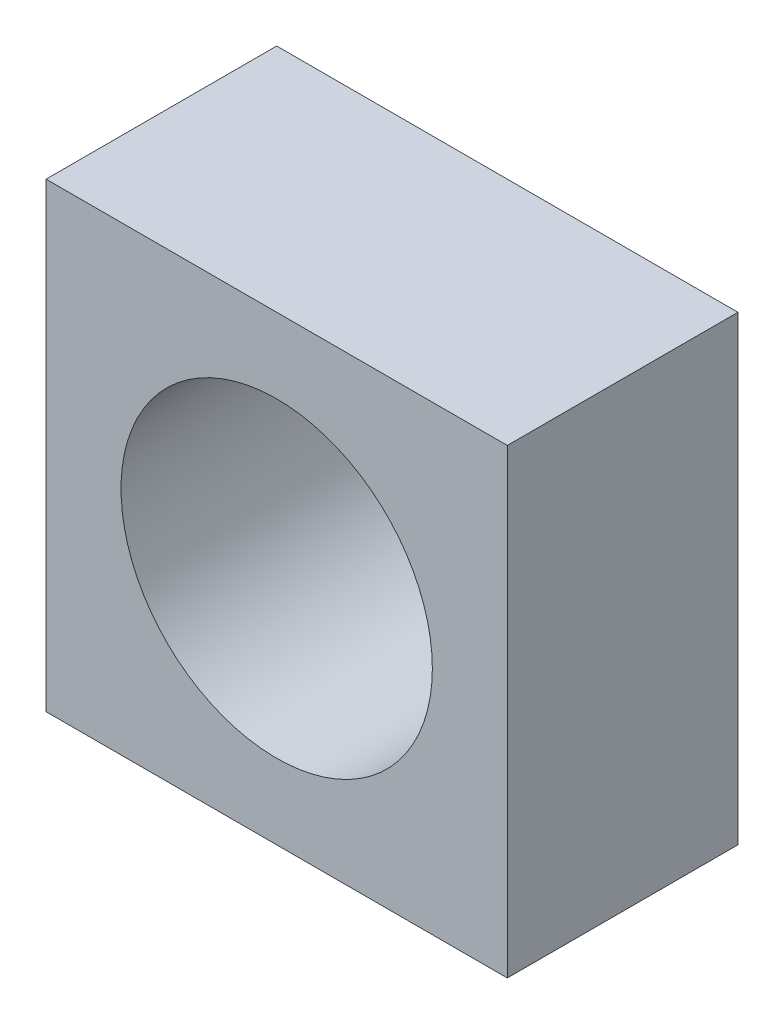
from build123d import *

# Parameters (mm, degrees)
SKETCH2_W                       = 8
SKETCH2_H                       = 8
REFERENCE_SQUARE_NUT_DEPTH      = 4
SKETCH3_R                       = 2.7
SIMPLIFIED_CLEARANCE_BORE_DEPTH = 4


with BuildPart() as part:
    # Sketch2 → Reference_square_nut (new body)
    with BuildSketch(Plane.XY):
        Rectangle(SKETCH2_W, SKETCH2_H)
    extrude(amount=REFERENCE_SQUARE_NUT_DEPTH)

    # Sketch3 → Simplified_clearance_bore (cut)
    with BuildSketch(Plane.XY):
        Circle(SKETCH3_R)
    extrude(amount=SIMPLIFIED_CLEARANCE_BORE_DEPTH, mode=Mode.SUBTRACT)


solid = part.part
